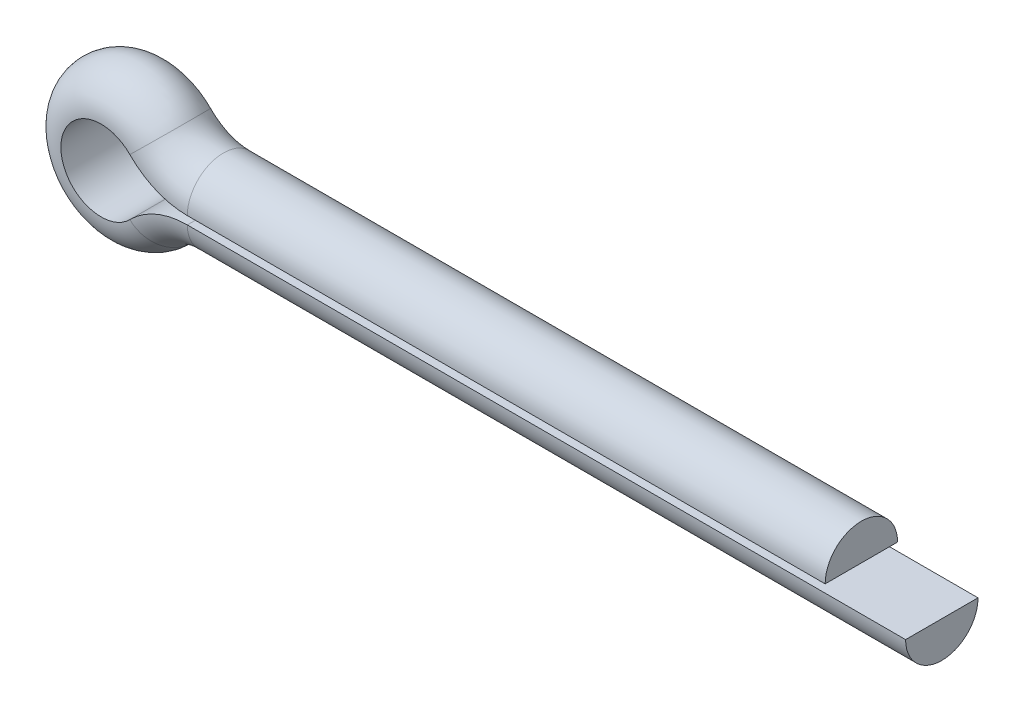
from build123d import *


with BuildPart() as part:
    # 掃出1: sweep along a path in 草圖1
    with BuildLine(Plane.XY) as sweep_1_path:
        Line((18, 0.1), (2.142428529, 0.1))
        ThreePointArc((2.142428529, 0.1), (1.367831859, 0.256091109), (0.714142843, 0.7))
        ThreePointArc((0.714142843, 0.7), (-1, 0), (0.714142843, -0.7))
        ThreePointArc((0.714142843, -0.7), (1.367831859, -0.256091109), (2.142428529, -0.1))
        Line((2.142428529, -0.1), (20, -0.1))
    # 草圖2 → 掃出1 (sweep)
    with BuildSketch(Plane(origin=(18, 0.1, 0), x_dir=(0, 0, 1), z_dir=(-1, 0, 0))):
        with BuildLine():
            Line((-0.9, 0), (0.9, 0))
            ThreePointArc((0.9, 0), (0, 0.9), (-0.9, 0))
        make_face()
    sweep(path=sweep_1_path.line)


solid = part.part
